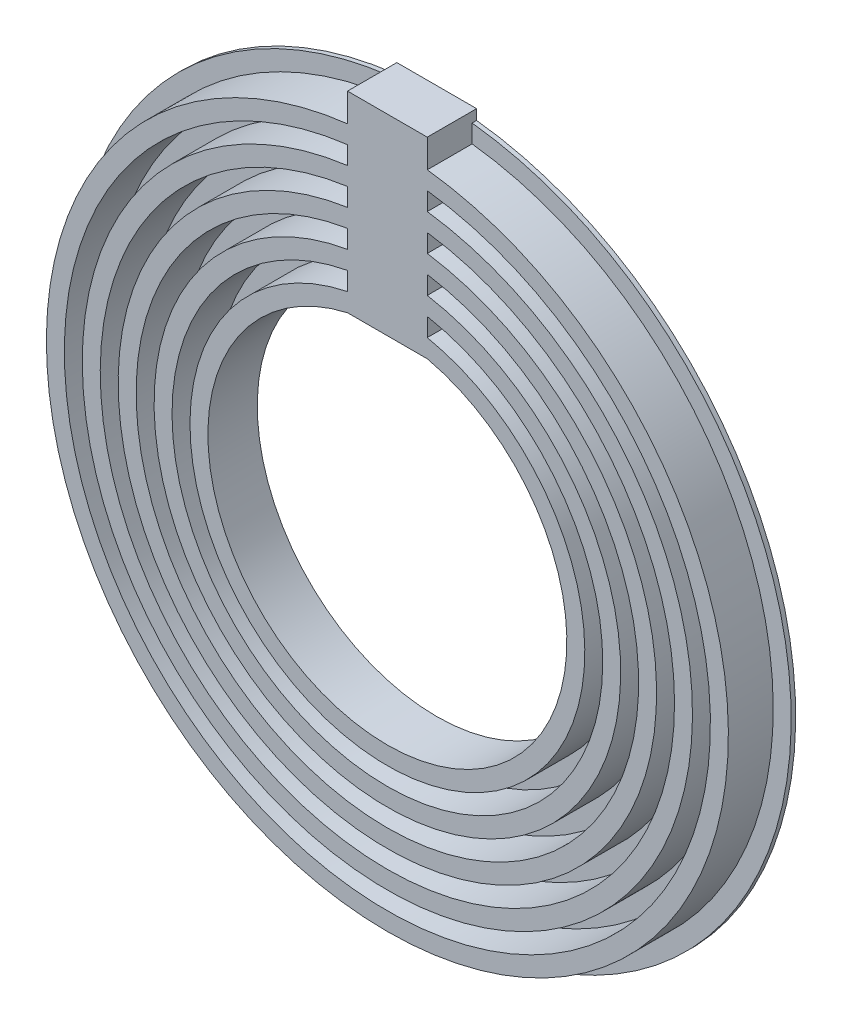
from build123d import *

# Parameters (mm, degrees)
CROQUIS1_R              = 20
CROQUIS1_R_2            = 10
SALIENTE_EXTRUIR1_DEPTH = 2.75
CORTAR_EXTRUIR1_START   = -2.5
CROQUIS2_R              = 20
CROQUIS2_R_2            = 19
CROQUIS2_R_3            = 18
CROQUIS2_R_4            = 17
CROQUIS2_R_5            = 16
CROQUIS2_R_6            = 15
CROQUIS2_R_7            = 14
CROQUIS2_R_8            = 13
CROQUIS2_R_9            = 12
CROQUIS2_R_10           = 11
CORTAR_EXTRUIR1_DEPTH   = 2.5
SALIENTE_EXTRUIR2_DEPTH = 2.75


with BuildPart() as part:
    # Croquis1 → Saliente-Extruir1 (new body)
    with BuildSketch(Plane.XY):
        Circle(CROQUIS1_R)
        Circle(CROQUIS1_R_2, mode=Mode.SUBTRACT)
    extrude(amount=SALIENTE_EXTRUIR1_DEPTH)

    # Croquis2 → Cortar-Extruir1 (cut)
    # profile 1 of 5: a face of its own
    with BuildSketch(Plane.XY.offset(2.75).offset(CORTAR_EXTRUIR1_START)):
        Circle(CROQUIS2_R)
        Circle(CROQUIS2_R_2, mode=Mode.SUBTRACT)
    # profile 2 of 5: a face of its own
    with BuildSketch(Plane.XY.offset(2.75).offset(CORTAR_EXTRUIR1_START)):
        Circle(CROQUIS2_R_3)
        Circle(CROQUIS2_R_4, mode=Mode.SUBTRACT)
    # profile 3 of 5: a face of its own
    with BuildSketch(Plane.XY.offset(2.75).offset(CORTAR_EXTRUIR1_START)):
        Circle(CROQUIS2_R_5)
        Circle(CROQUIS2_R_6, mode=Mode.SUBTRACT)
    # profile 4 of 5: a face of its own
    with BuildSketch(Plane.XY.offset(2.75).offset(CORTAR_EXTRUIR1_START)):
        Circle(CROQUIS2_R_7)
        Circle(CROQUIS2_R_8, mode=Mode.SUBTRACT)
    # profile 5 of 5: a face of its own
    with BuildSketch(Plane.XY.offset(2.75).offset(CORTAR_EXTRUIR1_START)):
        Circle(CROQUIS2_R_9)
        Circle(CROQUIS2_R_10, mode=Mode.SUBTRACT)
    extrude(amount=CORTAR_EXTRUIR1_DEPTH, mode=Mode.SUBTRACT)

    # Croquis3 → Saliente-Extruir2 (add)
    with BuildSketch(Plane.XY.offset(2.75)):
        Polygon((-2.222048604, 9.75), (0, 9.75), (2.222048604, 9.75), (2.222048604, 20.446693488), (-2.222048604, 20.446693488), align=None)
    extrude(amount=-SALIENTE_EXTRUIR2_DEPTH)


solid = part.part
